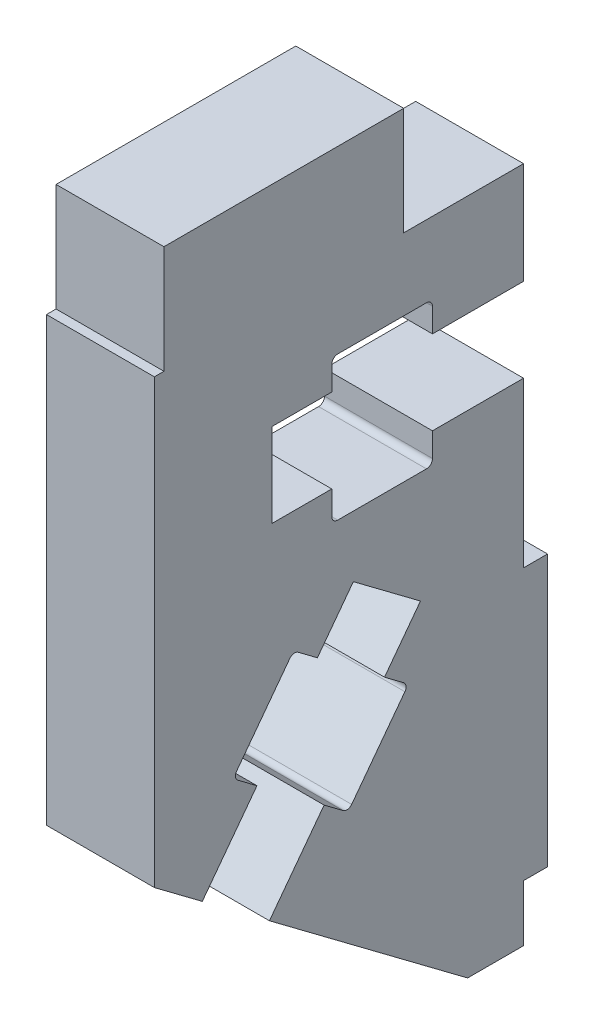
from build123d import *

# Parameters (mm, degrees)
BOSS_EXTRUDE1_DEPTH = 4.5
SKETCH2_W           = 1
SKETCH2_H           = 11.3
BOSS_EXTRUDE2_DEPTH = 4.5
CUT_EXTRUDE1_DEPTH  = 51.20209159
CUT_EXTRUDE2_DEPTH  = 51.20209159
CUT_EXTRUDE3_DEPTH  = 51.20209159
SKETCH8_W           = 10
SKETCH8_H           = 4.5
BOSS_EXTRUDE3_DEPTH = 4.5
CUT_EXTRUDE4_DEPTH  = 35.020728975


with BuildPart() as part:
    # Sketch1 → Boss-Extrude1 (new body)
    with BuildSketch(Plane(origin=(0, 0, 0), x_dir=(0, 0, -1), z_dir=(1, 0, 0))):
        Polygon((0, 0), (0, -30), (-40, 0), align=None)
    extrude(amount=BOSS_EXTRUDE1_DEPTH)

    # Sketch2 → Boss-Extrude2 (add, through all)
    with BuildSketch(Plane(origin=(4.5, 0, 0), x_dir=(0, 0, -1), z_dir=(1, 0, 0))):
        with Locations((0.5, -20.25)):
            Rectangle(SKETCH2_W, SKETCH2_H)
    extrude(amount=-BOSS_EXTRUDE2_DEPTH)

    # Sketch3 → Cut-Extrude1 (cut, through all)
    with BuildSketch(Plane(origin=(4.5, 0, 0), x_dir=(0, 0, -1), z_dir=(1, 0, 0))):
        with BuildLine():
            Line((0, -4.25), (-3.8, -4.25))
            Line((-3.8, -4.25), (-3.8, -3.25))
            ThreePointArc((-3.8, -3.25), (-3.873223305, -3.073223305), (-4.05, -3))
            Line((-4.05, -3), (-7.75, -3))
            ThreePointArc((-7.75, -3), (-7.926776695, -3.073223305), (-8, -3.25))
            Line((-8, -3.25), (-8, -4.25))
            Line((-8, -4.25), (-10.5, -4.25))
            Line((-10.5, -4.25), (-10.5, -7.75))
            Line((-10.5, -7.75), (-8, -7.75))
            Line((-8, -7.75), (-8, -8.75))
            ThreePointArc((-8, -8.75), (-7.926776695, -8.926776695), (-7.75, -9))
            Line((-7.75, -9), (-4.05, -9))
            ThreePointArc((-4.05, -9), (-3.873223305, -8.926776695), (-3.8, -8.75))
            Line((-3.8, -8.75), (-3.8, -7.75))
            Line((-3.8, -7.75), (0, -7.75))
            Line((0, -7.75), (0, -4.25))
        make_face()
    extrude(amount=-CUT_EXTRUDE1_DEPTH, mode=Mode.SUBTRACT)

    # Sketch4 → Cut-Extrude2 (cut, through all)
    with BuildSketch(Plane(origin=(4.5, 0, 0), x_dir=(0, 0, -1), z_dir=(1, 0, 0))):
        with BuildLine():
            Line((-10.6, -22.05), (-13.4, -19.95))
            Line((-13.4, -19.95), (-11.12, -16.91))
            Line((-11.12, -16.91), (-11.92, -16.31))
            ThreePointArc((-11.92, -16.31), (-12.017487373, -16.145355339), (-11.97, -15.96))
            Line((-11.97, -15.96), (-9.75, -13))
            ThreePointArc((-9.75, -13), (-9.585355339, -12.902512627), (-9.4, -12.95))
            Line((-9.4, -12.95), (-8.6, -13.55))
            Line((-8.6, -13.55), (-7.1, -11.55))
            Line((-7.1, -11.55), (-4.3, -13.65))
            Line((-4.3, -13.65), (-5.8, -15.65))
            Line((-5.8, -15.65), (-5, -16.25))
            ThreePointArc((-5, -16.25), (-4.902512627, -16.414644661), (-4.95, -16.6))
            Line((-4.95, -16.6), (-7.17, -19.56))
            ThreePointArc((-7.17, -19.56), (-7.334644661, -19.657487373), (-7.52, -19.61))
            Line((-7.52, -19.61), (-8.32, -19.01))
            Line((-8.32, -19.01), (-10.6, -22.05))
        make_face()
    extrude(amount=-CUT_EXTRUDE2_DEPTH, mode=Mode.SUBTRACT)

    # Sketch5 → Cut-Extrude3 (cut, through all)
    with BuildSketch(Plane(origin=(4.5, 0, 0), x_dir=(0, 0, -1), z_dir=(1, 0, 0))):
        Polygon((-15.4, -18.45), (-15.4, 0), (-40, 0), align=None)
    extrude(amount=-CUT_EXTRUDE3_DEPTH, mode=Mode.SUBTRACT)

    # Sketch8 → Boss-Extrude3 (add, through all)
    with BuildSketch(Plane(origin=(4.5, 0, 0), x_dir=(0, 0, -1), z_dir=(1, 0, 0))):
        with Locations((-10, 2.25)):
            Rectangle(SKETCH8_W, SKETCH8_H)
    extrude(amount=-BOSS_EXTRUDE3_DEPTH)

    # Sketch10 → Cut-Extrude4 (cut, through all)
    with BuildSketch(Plane(origin=(4.5, 0, 0), x_dir=(0, 0, -1), z_dir=(1, 0, 0))):
        Polygon((0, -28.25), (-2.333333333, -28.25), (0, -30), align=None)
    extrude(amount=-CUT_EXTRUDE4_DEPTH, mode=Mode.SUBTRACT)


solid = part.part
